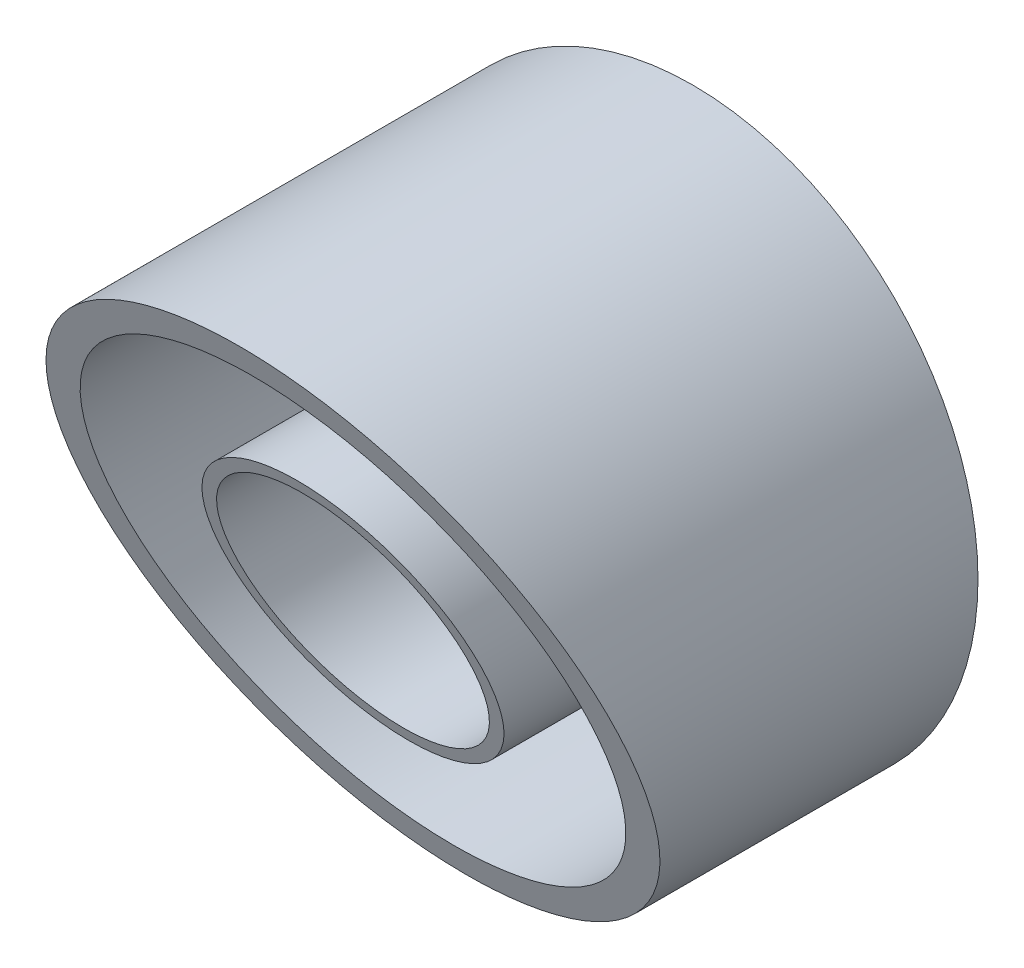
from build123d import *

# Parameters (mm, degrees)
SKETCH1_R               = 15.5
SKETCH1_R_2             = 14
BOSS_EXTRUDE2_DEPTH     = 50
SKETCH3_R               = 31.5
SKETCH3_R_2             = 28
BOSS_EXTRUDE3_DEPTH     = 50
CUT_EXTRUDE1_DEPTH      = 2500
CUT_EXTRUDE1_DEPTH_BACK = 10216
SKETCH15_R              = 27.962515844
SKETCH15_R_2            = 15.5
BOSS_EXTRUDE4_DEPTH     = 3


with BuildPart() as part:
    # Sketch1 → Boss-Extrude2 (new body)
    with BuildSketch(Plane.XY):
        Circle(SKETCH1_R)
        Circle(SKETCH1_R_2, mode=Mode.SUBTRACT)
    extrude(amount=BOSS_EXTRUDE2_DEPTH)


with BuildPart() as body_2:
    # Sketch3 → Boss-Extrude3 (new body)
    with BuildSketch(Plane.XY):
        Circle(SKETCH3_R)
        Circle(SKETCH3_R_2, mode=Mode.SUBTRACT)
    extrude(amount=BOSS_EXTRUDE3_DEPTH)


with BuildPart() as cut_extrude1_tool:
    # Sketch4 → Cut-Extrude1 (new, two sides: drawn at the far end of the back side and taken through both)
    with BuildSketch(Plane(origin=(0, 0, 0), x_dir=(0, 0, -1), z_dir=(1, 0, 0)).offset(-CUT_EXTRUDE1_DEPTH_BACK)):
        Polygon((-50, 31.5), (-25, -31.5), (-50, -31.5), align=None)
    extrude(amount=CUT_EXTRUDE1_DEPTH + CUT_EXTRUDE1_DEPTH_BACK)


with BuildPart() as part_1:
    add(part.part)

    # Cut-Extrude1: cut by cut_extrude1_tool
    add(cut_extrude1_tool.part, mode=Mode.SUBTRACT)

    # Sketch15 → Boss-Extrude4 (add)
    with BuildSketch(Plane(origin=(0, 0, 0), x_dir=(-1, 0, 0), z_dir=(0, 0, -1))):
        Circle(SKETCH15_R)
        Circle(SKETCH15_R_2, mode=Mode.SUBTRACT)
    extrude(amount=-BOSS_EXTRUDE4_DEPTH)


with BuildPart() as body_2_1:
    add(body_2.part)

    # Cut-Extrude1: cut by cut_extrude1_tool
    add(cut_extrude1_tool.part, mode=Mode.SUBTRACT)


solid = Compound([part_1.part, body_2_1.part])
